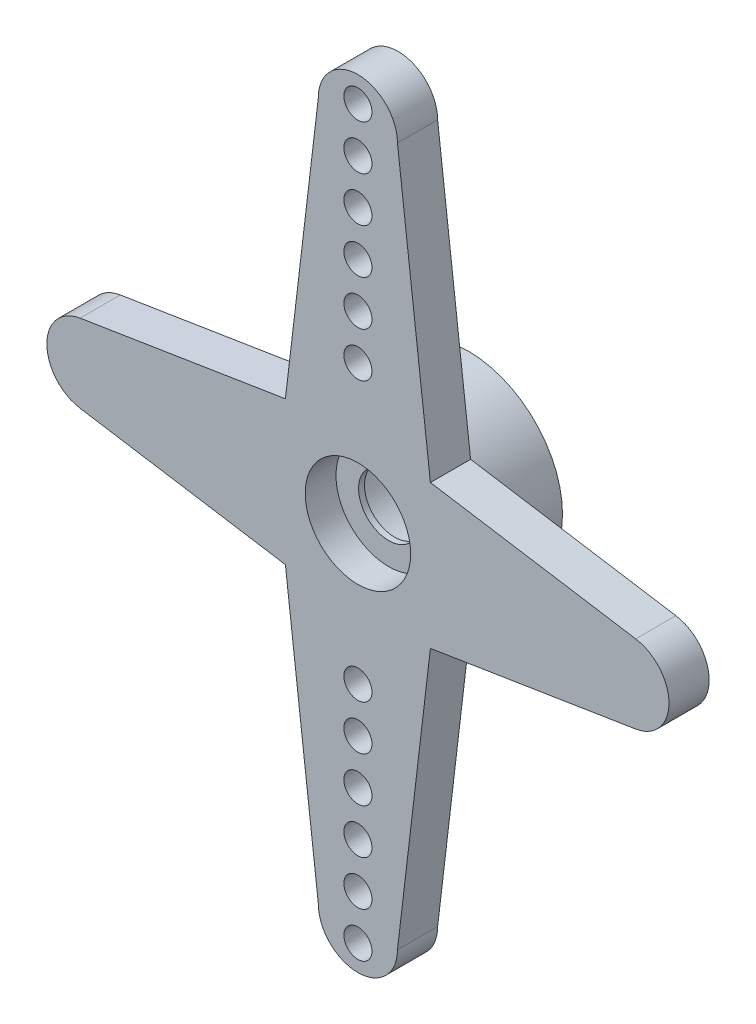
from build123d import *

# Parameters (mm, degrees)
SKETCH1_R           = 3.5687
SKETCH1_R_2         = 2
BOSS_EXTRUDE1_DEPTH = 4.191
SKETCH5_R           = 2
SKETCH5_R_2         = 1.143
BOSS_EXTRUDE2_DEPTH = 0.2226
BOSS_EXTRUDE3_START = -1.524
SKETCH6_R           = 0.5334
BOSS_EXTRUDE3_DEPTH = 1.524
BOSS_EXTRUDE4_START = -1.524
BOSS_EXTRUDE4_DEPTH = 1.524


with BuildPart() as part:
    # Sketch1 → Boss-Extrude1 (new body)
    with BuildSketch(Plane.XY.offset(-7.032965862)):
        with Locations((-5.5, 0)):
            Circle(SKETCH1_R)
        with Locations((-5.5, 0)):
            Circle(SKETCH1_R_2, mode=Mode.SUBTRACT)
    extrude(amount=BOSS_EXTRUDE1_DEPTH)

    # Sketch5 → Boss-Extrude2 (add)
    with BuildSketch(Plane.XY.offset(-4.232965862)):
        with Locations((-5.5, 0)):
            Circle(SKETCH5_R)
        with Locations((-5.5, 0)):
            Circle(SKETCH5_R_2, mode=Mode.SUBTRACT)
    extrude(amount=BOSS_EXTRUDE2_DEPTH)

    # Sketch6 → Boss-Extrude3 (add)
    with BuildSketch(Plane.XY.offset(-2.841965862).offset(BOSS_EXTRUDE3_START)):
        with BuildLine():
            Line((-4, -13.25), (-2.68695, -2.195989387))
            ThreePointArc((-2.68695, -2.195989387), (-5.5, -3.5687), (-8.31305, -2.195989387))
            Line((-8.31305, -2.195989387), (-7, -13.25))
            ThreePointArc((-7, -13.25), (-5.5, -14.75), (-4, -13.25))
        make_face()
        with Locations((-5.5, -12.0816)):
            Circle(SKETCH6_R, mode=Mode.SUBTRACT)
        with Locations((-5.5, -13.7834)):
            Circle(SKETCH6_R, mode=Mode.SUBTRACT)
        with Locations((-5.5, -10.3798)):
            Circle(SKETCH6_R, mode=Mode.SUBTRACT)
        with Locations((-5.5, -8.678)):
            Circle(SKETCH6_R, mode=Mode.SUBTRACT)
        with Locations((-5.5, -6.9762)):
            Circle(SKETCH6_R, mode=Mode.SUBTRACT)
        with Locations((-5.5, -5.2744)):
            Circle(SKETCH6_R, mode=Mode.SUBTRACT)
    boss_extrude3 = extrude(amount=BOSS_EXTRUDE3_DEPTH)

    # Mirror1: Boss-Extrude3 across plane
    add(boss_extrude3.mirror(Plane.ZX))

    # Sketch7 → Boss-Extrude4 (add)
    with BuildSketch(Plane.XY.offset(-2.841965862).offset(BOSS_EXTRUDE4_START)):
        with BuildLine():
            Line((-16.036523348, -1.481234859), (-7.695989387, -2.81305))
            ThreePointArc((-7.695989387, -2.81305), (-9.0687, 0), (-7.695989387, 2.81305))
            Line((-7.695989387, 2.81305), (-16.036523348, 1.481234859))
            ThreePointArc((-16.036523348, 1.481234859), (-17.3, 0), (-16.036523348, -1.481234859))
        make_face()
    boss_extrude4 = extrude(amount=BOSS_EXTRUDE4_DEPTH)

    # Mirror2: Boss-Extrude4 across plane
    add(boss_extrude4.mirror(Plane.ZY.offset(5.5)))


solid = part.part
